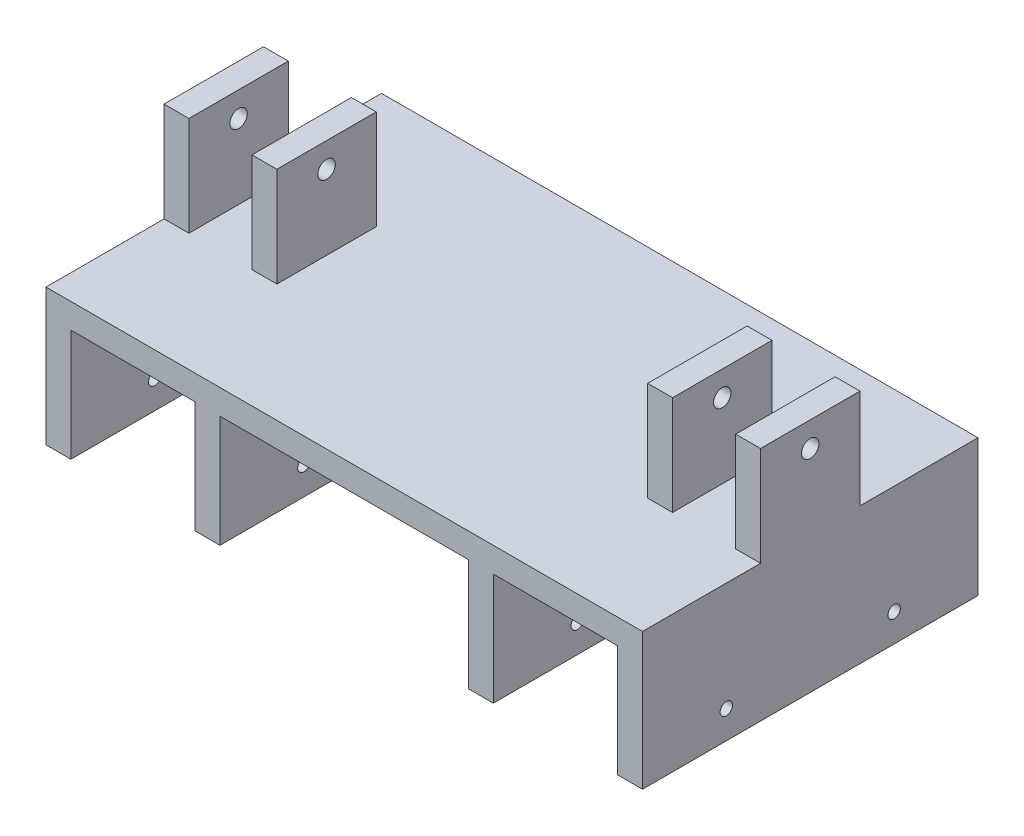
from build123d import *

# Parameters (mm, degrees)
BOSS_EXTRUDE1_DEPTH     = 135
SKETCH3_W               = 10
SKETCH3_H               = 135
BOSS_EXTRUDE2_DEPTH     = 45
CUT_EXTRUDE1_DEPTH      = 230
CUT_EXTRUDE1_DEPTH_BACK = 10
SKETCH4_W               = 10
SKETCH4_H               = 20
BOSS_EXTRUDE3_DEPTH     = 40
CUT_EXTRUDE2_DEPTH      = 281.802421642
CUT_EXTRUDE2_DEPTH_BACK = 240


with BuildPart() as part:
    # Sketch1 → Boss-Extrude1 (new body)
    with BuildSketch(Plane.XY):
        Polygon((-120, 0), (120, 0), (120, -55), (110, -55), (110, -10), (-110, -10), (-110, -55), (-120, -55), align=None)
    extrude(amount=BOSS_EXTRUDE1_DEPTH)

    # Sketch3 → Boss-Extrude2 (add)
    with BuildSketch(Plane.XZ.offset(10)):
        with Locations((55, 67.5)):
            Rectangle(SKETCH3_W, SKETCH3_H)
        with Locations((-55, 67.5)):
            Rectangle(SKETCH3_W, SKETCH3_H)
    extrude(amount=BOSS_EXTRUDE2_DEPTH)

    # Sketch2 → Cut-Extrude1 (cut, two sides: drawn at the far end of the back side and taken through both)
    with BuildSketch(Plane.ZY.offset(-110).offset(-CUT_EXTRUDE1_DEPTH_BACK)):
        with BuildLine():
            ThreePointArc((31.25, -43.75), (33.75, -46.25), (36.25, -43.75))
            Line((36.25, -43.75), (33.75, -43.75))
            Line((33.75, -43.75), (31.25, -43.75))
        make_face()
        with BuildLine():
            Line((33.75, -43.75), (36.25, -43.75))
            ThreePointArc((36.25, -43.75), (33.75, -41.25), (31.25, -43.75))
            Line((31.25, -43.75), (33.75, -43.75))
        make_face()
        with BuildLine():
            Line((98.75, -43.75), (101.25, -43.75))
            Line((101.25, -43.75), (103.75, -43.75))
            ThreePointArc((103.75, -43.75), (101.25, -41.25), (98.75, -43.75))
        make_face()
        with BuildLine():
            Line((103.75, -43.75), (101.25, -43.75))
            Line((101.25, -43.75), (98.75, -43.75))
            ThreePointArc((98.75, -43.75), (101.25, -46.25), (103.75, -43.75))
        make_face()
    extrude(amount=CUT_EXTRUDE1_DEPTH + CUT_EXTRUDE1_DEPTH_BACK, mode=Mode.SUBTRACT)

    # Sketch4 → Boss-Extrude3 (add)
    with BuildSketch(Plane(origin=(0, 0, 0), x_dir=(1, 0, 0), z_dir=(0, 1, 0))):
        with Locations((-115, -57.5)):
            Rectangle(SKETCH4_W, SKETCH4_H)
        with Locations((-115, -77.5)):
            Rectangle(SKETCH4_W, SKETCH4_H)
        with Locations((-79.6, -77.5)):
            Rectangle(SKETCH4_W, SKETCH4_H)
        with Locations((-79.6, -57.5)):
            Rectangle(SKETCH4_W, SKETCH4_H)
        with Locations((79.6, -57.5)):
            Rectangle(SKETCH4_W, SKETCH4_H)
        with Locations((79.6, -77.5)):
            Rectangle(SKETCH4_W, SKETCH4_H)
        with Locations((115, -77.5)):
            Rectangle(SKETCH4_W, SKETCH4_H)
        with Locations((115, -57.5)):
            Rectangle(SKETCH4_W, SKETCH4_H)
    extrude(amount=BOSS_EXTRUDE3_DEPTH)

    # Sketch5 → Cut-Extrude2 (cut, two sides: drawn at the far end of the back side and taken through both)
    with BuildSketch(Plane(origin=(120, 0, 0), x_dir=(0, 0, -1), z_dir=(1, 0, 0)).offset(-CUT_EXTRUDE2_DEPTH_BACK)):
        with BuildLine():
            ThreePointArc((-67.5, 33.5), (-71, 30), (-67.5, 26.5))
            Line((-67.5, 26.5), (-67.5, 30))
            Line((-67.5, 30), (-67.5, 33.5))
        make_face()
        with BuildLine():
            Line((-67.5, 30), (-67.5, 26.5))
            ThreePointArc((-67.5, 26.5), (-65.025126266, 27.525126266), (-64, 30))
            ThreePointArc((-64, 30), (-65.025126266, 32.474873734), (-67.5, 33.5))
            Line((-67.5, 33.5), (-67.5, 30))
        make_face()
    extrude(amount=CUT_EXTRUDE2_DEPTH + CUT_EXTRUDE2_DEPTH_BACK, mode=Mode.SUBTRACT)


solid = part.part
